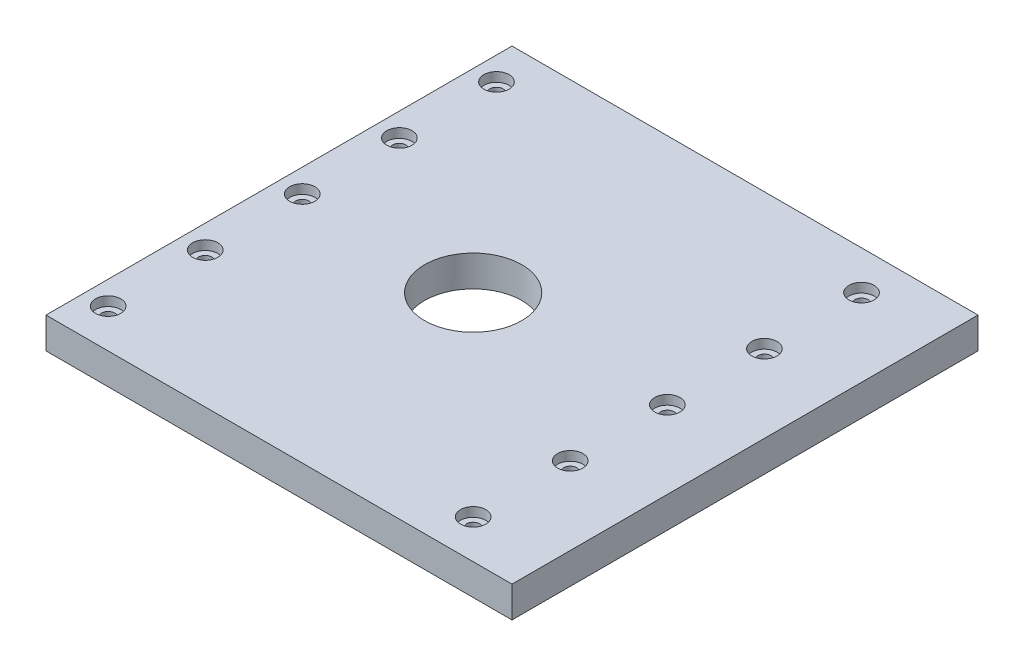
from build123d import *

# Parameters (mm, degrees)
SKETCH1_W                                            = 120
SKETCH1_H                                            = 120
BOSS_EXTRUDE1_DEPTH                                  = 8
CBORE_FOR_M3_HEX_SOCKET_THIN_HEAD_CAP_SC_D           = 3.4
CBORE_FOR_M3_HEX_SOCKET_THIN_HEAD_CAP_SC_CBORE_D     = 6.5
CBORE_FOR_M3_HEX_SOCKET_THIN_HEAD_CAP_SC_CBORE_DEPTH = 2.4
F_25_0MM_DOWEL_HOLE1_D                               = 25
F_25_0MM_DOWEL_HOLE1_DEPTH                           = 10
F_25_0MM_DOWEL_HOLE1_TIP                             = 7.510757738


with BuildPart() as part:
    # Sketch1 → Boss-Extrude1 (new body)
    with BuildSketch(Plane(origin=(0, 0, 0), x_dir=(1, 0, 0), z_dir=(0, 1, 0))):
        with Locations((60, 60)):
            Rectangle(SKETCH1_W, SKETCH1_H)
    extrude(amount=BOSS_EXTRUDE1_DEPTH)

    # CBORE for M3 Hex Socket Thin Head Cap Screw1 (through all)
    with Locations(Plane(origin=(0, 8, 0), x_dir=(1, 0, 0), z_dir=(0, 1, 0))):
        with Locations((100, 110), (6, 110), (6, 85), (6, 60), (6, 35), (6, 10), (100, 60), (100, 35), (100, 10), (100, 85)):
            CounterBoreHole(CBORE_FOR_M3_HEX_SOCKET_THIN_HEAD_CAP_SC_D / 2, CBORE_FOR_M3_HEX_SOCKET_THIN_HEAD_CAP_SC_CBORE_D / 2, CBORE_FOR_M3_HEX_SOCKET_THIN_HEAD_CAP_SC_CBORE_DEPTH)

    # Ø25.0mm Dowel Hole1
    with Locations(Plane(origin=(0, 8, 0), x_dir=(1, 0, 0), z_dir=(0, 1, 0))):
        with Locations((50, 60)):
            Hole(F_25_0MM_DOWEL_HOLE1_D / 2, depth=F_25_0MM_DOWEL_HOLE1_DEPTH)
            with Locations((0, 0, -(F_25_0MM_DOWEL_HOLE1_DEPTH + F_25_0MM_DOWEL_HOLE1_TIP / 2))):  # 118° drill point
                Cone(0, F_25_0MM_DOWEL_HOLE1_D / 2, F_25_0MM_DOWEL_HOLE1_TIP, mode=Mode.SUBTRACT)


solid = part.part
